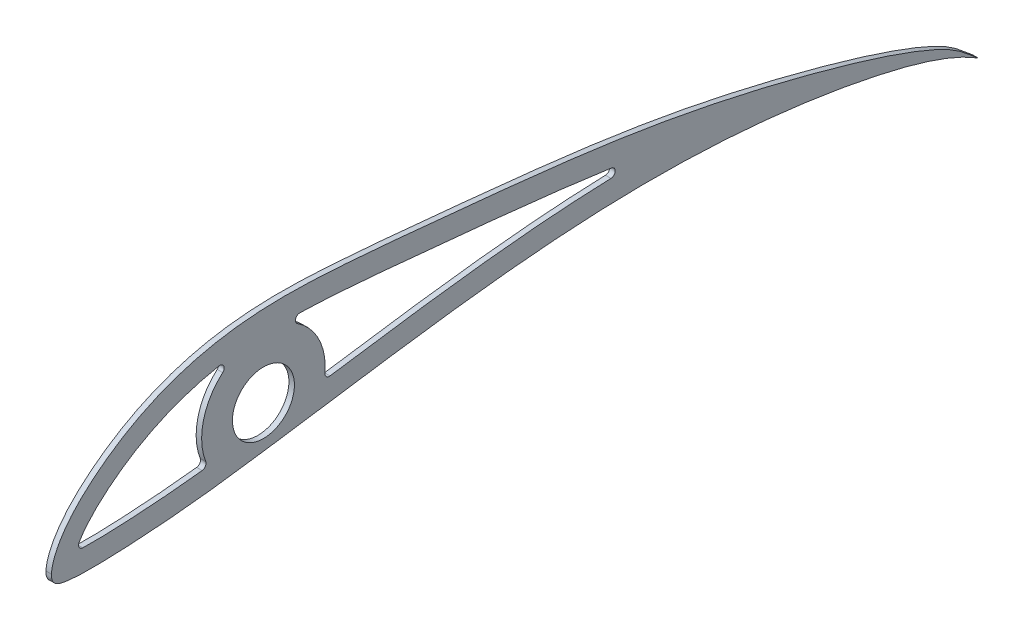
from build123d import *

# Parameters (mm, degrees)
BOSS_EXTRUDE1_DEPTH = 3.175
CUT_EXTRUDE1_DEPTH  = 780.716781801
FILLET1_R           = 2.54


with BuildPart() as part:
    # Sketch1 → Boss-Extrude1 (new body)
    with BuildSketch(Plane(origin=(374.396, 0, 0), x_dir=(0, 0, -1), z_dir=(1, 0, 0))):
        with BuildLine():
            add(Edge.make_bspline(
                [(241.3, 0), (241.297655185, -0.53895466), (241.292490042, -1.726160333), (241.690170496, -3.554756901), (242.787647349, -5.285750443), (244.559100968, -6.478197036), (246.693492664, -7.234399617), (249.13102664, -7.749349513), (251.905250666, -8.109552457), (255.097825264, -8.365361309), (258.834169307, -8.539277754), (263.297687326, -8.62282221), (268.751433245, -8.598454119), (275.5550069, -8.430434414), (284.115477039, -8.068973839), (294.701993417, -7.467296112), (307.238662481, -6.565509351), (321.351176792, -5.267746603), (336.635216145, -3.498612117), (352.842840734, -1.31741886), (369.808726727, 1.121625696), (387.306924799, 3.704841508), (405.053096078, 6.350855724), (422.799408726, 8.98235684), (440.376908078, 11.530022791), (457.707871032, 13.943001068), (474.772580756, 16.172906662), (491.576454149, 18.185283163), (508.136887078, 19.944519492), (524.480515327, 21.422853165), (540.633952092, 22.600664832), (556.62591669, 23.45702203), (572.479352869, 23.981185901), (588.217968125, 24.158904157), (603.859249006, 23.982843705), (619.418444987, 23.445613), (634.897947787, 22.545522915), (650.289014071, 21.280364951), (665.556610194, 19.655496457), (680.627419738, 17.677015917), (695.363311814, 15.374920464), (709.53869208, 12.782897075), (722.850908635, 9.970758518), (734.983994697, 7.012558215), (745.710637795, 3.966527935), (754.965559993, 0.871097223), (762.812999366, -2.267646124), (769.870558631, -5.550908071), (774.178423342, -8.05223933), (776.396489798, -9.340143972)],
                knots=[0, 0, 0, 0, 0.002956996, 0.00651365, 0.010125385, 0.013911575, 0.018000428, 0.022509132, 0.027570198, 0.033355256, 0.040093935, 0.04810894, 0.057869876, 0.070043142, 0.08548232, 0.104922628, 0.128274622, 0.15450638, 0.182746709, 0.212765693, 0.244315985, 0.276878379, 0.309904596, 0.342852711, 0.375404074, 0.407445979, 0.438949076, 0.46991622, 0.500387508, 0.530404995, 0.560035324, 0.589330242, 0.618350498, 0.64714112, 0.675762771, 0.704247977, 0.732632991, 0.760909446, 0.789050397, 0.816945539, 0.844377955, 0.870950737, 0.896076017, 0.919089977, 0.939522088, 0.957298391, 0.972656028, 0.985920926, 1, 1, 1, 1], degree=3))
            add(Edge.make_bspline(
                [(776.396489798, -9.340143972), (775.264229702, -8.401754843), (772.482179212, -6.096060289), (768.02376491, -2.179435062), (762.218322929, 1.848598359), (755.243229686, 5.600344911), (746.912760701, 9.335471689), (737.018252872, 13.238608907), (725.478678298, 17.316182183), (712.428375503, 21.511581953), (698.167711363, 25.742123335), (683.062552056, 29.924039537), (667.444717495, 33.98191971), (651.563094479, 37.85878072), (635.571677799, 41.50756827), (619.542134961, 44.896204556), (603.480438345, 48.006262968), (587.348007897, 50.838453128), (571.079262558, 53.403726763), (554.597347915, 55.729750545), (537.831743695, 57.85187895), (520.741731841, 59.820394331), (503.340217598, 61.685647383), (485.710728793, 63.489925988), (468.011203684, 65.249891359), (450.459510763, 66.951772198), (433.311455419, 68.537866027), (416.841536857, 69.928915106), (401.296477174, 71.032768307), (386.808729153, 71.72962729), (373.351309187, 71.893808625), (360.783321416, 71.460297851), (348.941977506, 70.418471993), (337.701052478, 68.763422594), (326.980618986, 66.498526744), (316.739864215, 63.636475775), (306.973125092, 60.206334855), (297.713837698, 56.245375833), (289.029736202, 51.836604691), (281.025296442, 47.111336501), (273.817045833, 42.256369896), (267.502444449, 37.467593908), (262.111076339, 32.912011319), (257.60990674, 28.671099792), (253.911291371, 24.75953821), (250.902182399, 21.157238831), (248.463647547, 17.839519641), (246.491901816, 14.780198822), (244.907396988, 11.95061486), (243.649534234, 9.323214964), (242.679778652, 6.870618395), (241.966757378, 4.571586925), (241.49505501, 2.40963479), (241.323981846, 0.89423705), (241.302884141, 0.107544092), (241.3, 0)],
                knots=[0, 0, 0, 0, 0.007664021, 0.018831091, 0.030906188, 0.044388541, 0.060047408, 0.078460679, 0.099804721, 0.12381697, 0.149890658, 0.177317926, 0.205492409, 0.233979752, 0.262509716, 0.290967606, 0.319357501, 0.347763188, 0.376320626, 0.405182951, 0.434503841, 0.464386678, 0.494832433, 0.525708039, 0.556739737, 0.587525558, 0.61760481, 0.646485108, 0.673660143, 0.698815639, 0.722062594, 0.743776306, 0.764323118, 0.783977995, 0.802952239, 0.821385981, 0.839352414, 0.8568587, 0.873830573, 0.890070808, 0.90526801, 0.919095859, 0.931350851, 0.942034396, 0.951307872, 0.959388408, 0.966479389, 0.97275201, 0.978344066, 0.983368996, 0.987921252, 0.992076472, 0.995898894, 0.999439362, 1, 1, 1, 1], degree=3))
        make_face()
    extrude(amount=BOSS_EXTRUDE1_DEPTH)

    # Sketch2 → Cut-Extrude1 (cut, through all)
    with BuildSketch(Plane(origin=(377.571, 0, 0), x_dir=(0, 0, -1), z_dir=(1, 0, 0))):
        with BuildLine():
            ThreePointArc((379.04636246, 15.324611592), (380.951295192, 19.760481307), (381.602038165, 24.54402))
            ThreePointArc((381.602038165, 24.54402), (356.492174578, 40.938513133), (351.582559178, 11.355066223))
            add(Edge.make_bspline(
                [(351.582559178, 11.355066223), (356.265745024, 12.008107445), (365.415600248, 13.319672696), (374.5803233, 14.665007533), (379.04636246, 15.324611592)],
                knots=[0.214197781, 0.214197781, 0.214197781, 0.214197781, 0.24034959, 0.265181259, 0.265181259, 0.265181259, 0.265181259], degree=3))
        make_face()
        with BuildLine():
            add(Edge.make_bspline(
                [(351.582559178, 11.355066223), (356.265745024, 12.008107445), (365.415600248, 13.319672696), (374.5803233, 14.665007533), (379.04636246, 15.324611592)],
                knots=[0.214197781, 0.214197781, 0.214197781, 0.214197781, 0.24034959, 0.265181259, 0.265181259, 0.265181259, 0.265181259], degree=3))
            ThreePointArc((351.582559178, 11.355066223), (366.256649444, 6.821187364), (379.04636246, 15.324611592))
        make_face()
        with BuildLine():
            add(Edge.make_bspline(
                [(255.377185534, 4.36288667), (255.793743652, 4.334163158), (257.443622467, 4.232671128), (260.385262371, 4.124755375), (264.272071992, 4.079660125), (269.534885175, 4.115144762), (276.221987455, 4.299250748), (284.335721477, 4.665013102), (292.479657406, 5.131621739), (303.337707319, 5.87136067), (316.403072474, 6.989174344), (326.741613568, 8.138925459), (331.698805905, 8.738859765)],
                knots=[0.032586091, 0.032586091, 0.032586091, 0.032586091, 0.03524398, 0.042840484, 0.050436988, 0.058033492, 0.0732265, 0.088419508, 0.103612516, 0.118805525, 0.149191541, 0.177061203, 0.177061203, 0.177061203, 0.177061203], degree=3))
            ThreePointArc((331.698805905, 8.738859765), (330.379268425, 37.335480258), (350.497663758, 57.701089799))
            add(Edge.make_bspline(
                [(350.497663758, 57.701089799), (347.402988564, 57.339065965), (338.786837419, 56.109800238), (324.929081986, 53.02515322), (309.250747175, 47.669892828), (296.853155061, 41.72832375), (287.401686712, 36.10695207), (280.579302189, 31.482694683), (274.062345594, 26.464664315), (267.971682208, 21.112746184), (263.470207509, 16.445052767), (260.344801732, 12.598539364), (258.251880884, 9.646569184), (256.761376029, 7.168271606), (255.855063771, 5.405479548), (255.502443884, 4.64511763), (255.377185532, 4.362886676)],
                knots=[0.763908639, 0.763908639, 0.763908639, 0.763908639, 0.78125, 0.8125, 0.84375, 0.875, 0.890625, 0.90625, 0.921875, 0.9375, 0.953125, 0.9609375, 0.96875, 0.9765625, 0.98046875, 0.982823078, 0.982823078, 0.982823078, 0.982823078], degree=3))
        make_face()
        with BuildLine():
            ThreePointArc((399.382038165, 24.54402), (399.24243736, 21.390548978), (398.824727128, 18.261749523))
            add(Edge.make_bspline(
                [(398.824727128, 18.261749523), (404.174294086, 19.057892074), (420.483269537, 21.482925859), (447.824844758, 25.458755213), (480.969230285, 29.82939965), (514.342263519, 33.434495373), (547.933715805, 35.92941416), (574.504963126, 36.800195316), (589.847745485, 36.809791227), (593.922590851, 36.776754891)],
                knots=[0.301810356, 0.301810356, 0.301810356, 0.301810356, 0.331507639, 0.392279672, 0.453051705, 0.513823738, 0.57459577, 0.635367803, 0.657339639, 0.657339639, 0.657339639, 0.657339639], degree=3))
            add(Edge.make_bspline(
                [(593.922590851, 36.776754891), (585.96743274, 38.179075604), (566.314002563, 41.380604958), (534.762616141, 45.536352152), (499.176755881, 49.38661918), (463.420919951, 52.957148941), (433.66204166, 55.800441885), (409.970393815, 57.726501869), (391.539271821, 58.891312615), (379.196232019, 59.165433046), (372.698642706, 59.076570937)],
                knots=[0.332325242, 0.332325242, 0.332325242, 0.332325242, 0.375, 0.4375, 0.5, 0.5625, 0.625, 0.65625, 0.6875, 0.722989214, 0.722989214, 0.722989214, 0.722989214], degree=3))
            ThreePointArc((372.698642706, 59.076570937), (391.933961695, 46.364312548), (399.382038165, 24.54402))
        make_face()
    extrude(amount=-CUT_EXTRUDE1_DEPTH, mode=Mode.SUBTRACT)

    # Fillet1
    fillet1_edges = [part.edges().sort_by_distance(p)[0] for p in [
        (375.9835, 36.776754891, -593.922590851),
        (375.9835, 4.362886673, -255.377185533),
        (375.9835, 18.261749523, -398.824727128),
        (375.9835, 8.738859765, -331.698805905),
        (375.9835, 59.076570937, -372.698642706),
        (375.9835, 57.701089799, -350.497663758),
    ]]
    fillet(fillet1_edges, radius=FILLET1_R)


solid = part.part
